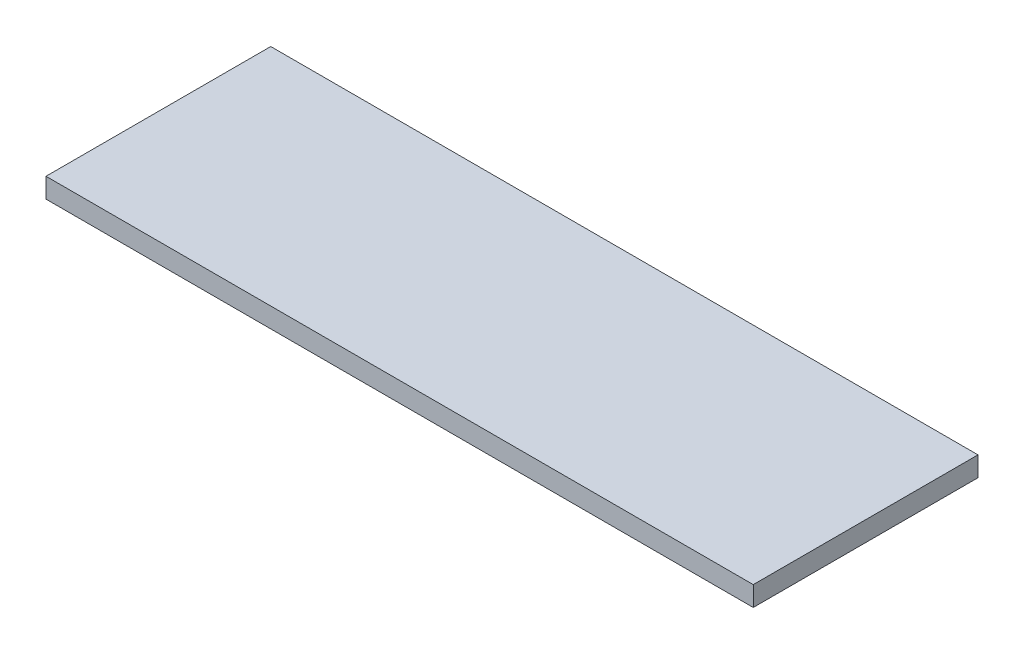
from build123d import *

# Parameters (mm, degrees)
SKETCH1_W           = 107
SKETCH1_H           = 34
BOSS_EXTRUDE1_DEPTH = 3


with BuildPart() as part:
    # Sketch1 → Boss-Extrude1 (new body)
    with BuildSketch(Plane(origin=(0, 0, 0), x_dir=(1, 0, 0), z_dir=(0, 1, 0))):
        with Locations((53.5, 17)):
            Rectangle(SKETCH1_W, SKETCH1_H)
    extrude(amount=BOSS_EXTRUDE1_DEPTH)


solid = part.part
